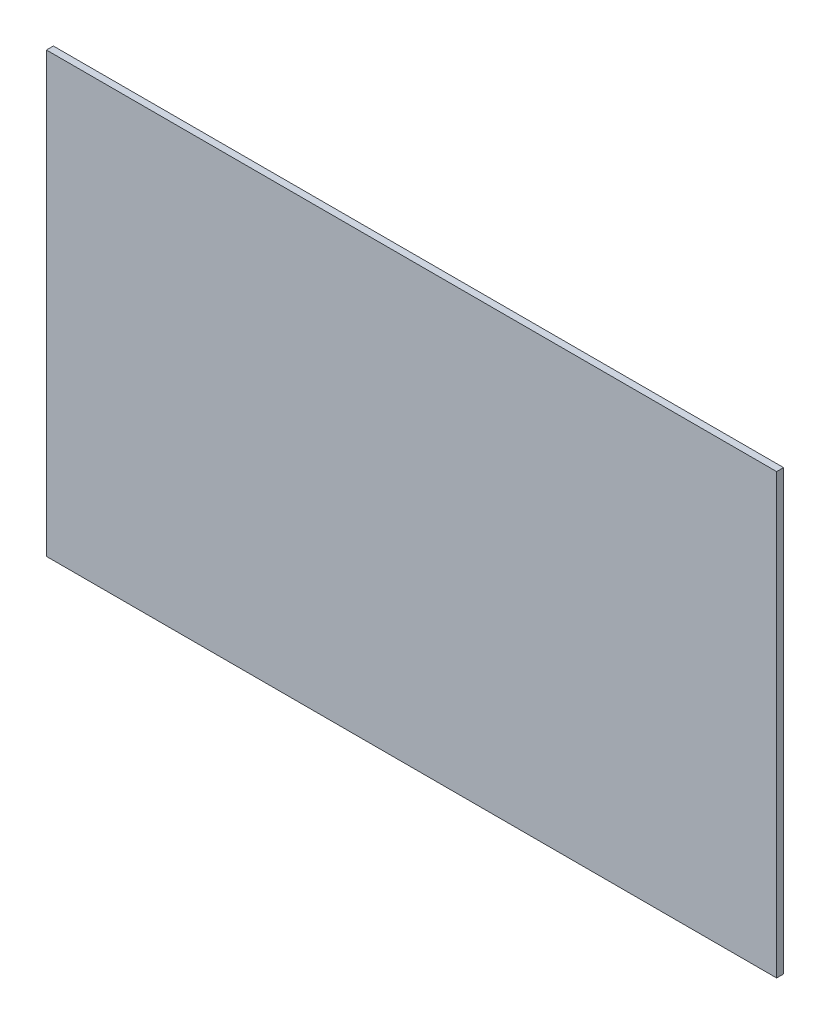
from build123d import *

# Parameters (mm, degrees)
SKETCH_1_W      = 500.8
SKETCH_1_H      = 300.8
EXTRUDE_1_DEPTH = 4.75


with BuildPart() as part:
    # 草圖1 → 填料-伸長1 (new body)
    with BuildSketch(Plane.XY):
        Rectangle(SKETCH_1_W, SKETCH_1_H)
    extrude(amount=EXTRUDE_1_DEPTH)


solid = part.part
